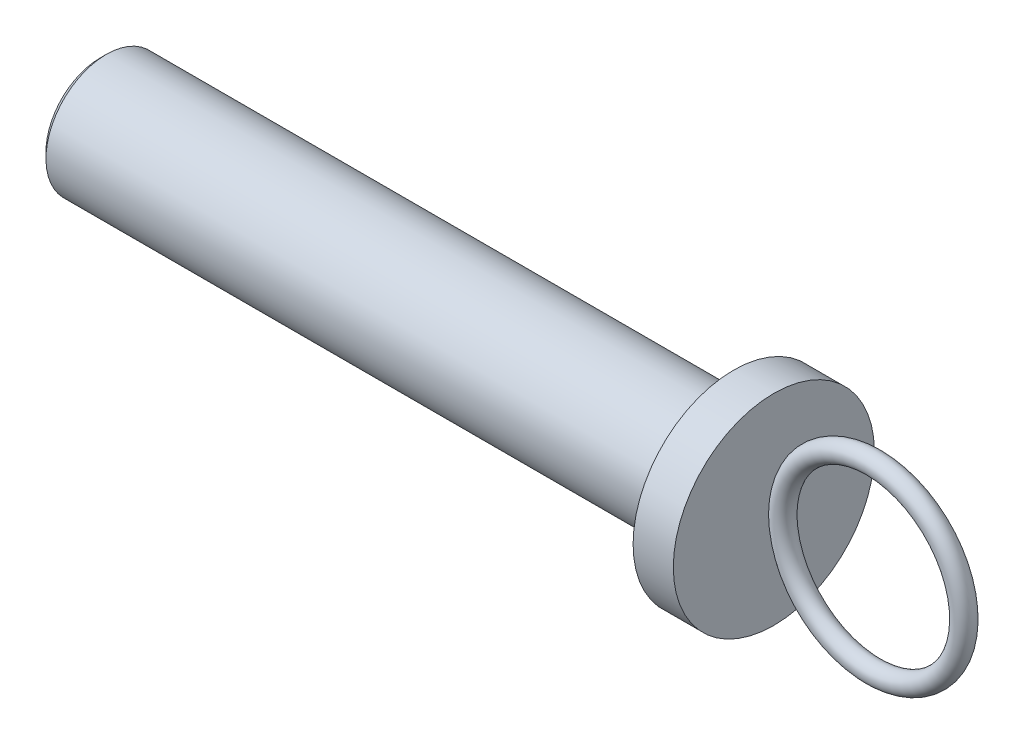
from build123d import *

# Parameters (mm, degrees)
SKETCH_2_R = 5


with BuildPart() as part:
    # 草图1 → 旋转1 (revolve)
    with BuildSketch(Plane.XY):
        Polygon((0, 0), (-335, 0), (-335, 27), (-332, 30), (-20, 30), (-20, 50), (0, 50), align=None)
    revolve(axis=Axis((0, 0, 0), (-1, 0, 0)))

    # 草图2 → 旋转2 (revolve)
    with BuildSketch(Plane(origin=(0, 0, 0), x_dir=(1, 0, 0), z_dir=(0, 1, 0)), mode=Mode.PRIVATE) as revolve_2_sk:
        with Locations((4.5, 0)):
            Circle(SKETCH_2_R)
    revolve(revolve_2_sk.sketch.rotate(Axis((49.5, 0, 1000), (0, 0, -1)), 265.94519807), axis=Axis((49.5, 0, 1000), (0, 0, -1)))


solid = part.part
